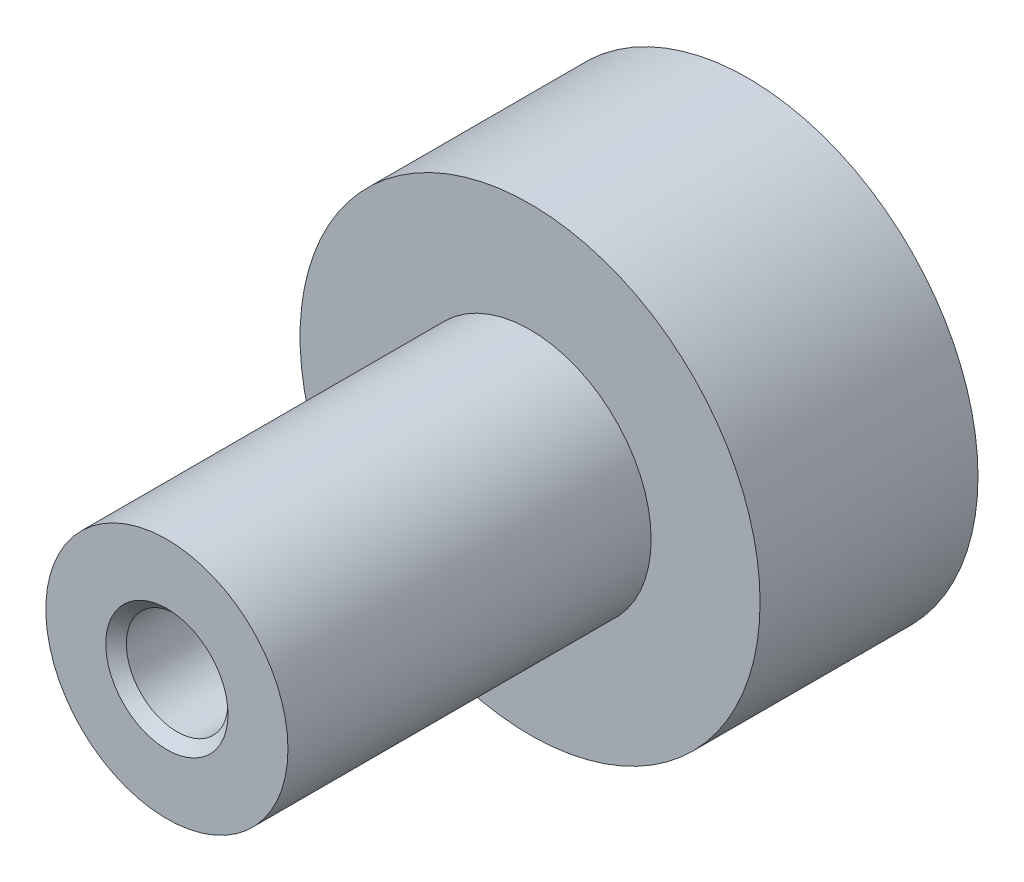
from build123d import *

# Parameters (mm, degrees)
SKETCH1_R                   = 9.5
SKETCH1_R_2                 = 8
BOSS_EXTRUDE1_DEPTH         = 6
SKETCH2_R                   = 9.5
BOSS_EXTRUDE2_DEPTH         = 3
SKETCH3_R                   = 5
BOSS_EXTRUDE3_DEPTH         = 15
CUT_EXTRUDE1_DEPTH          = 6
CIRPATTERN1_COUNT           = 5
M5_TAPPED_HOLE1_D           = 4.2
M5_TAPPED_HOLE1_DEPTH       = 15
M5_TAPPED_HOLE1_CSINK_D     = 5.05
M5_TAPPED_HOLE1_CSINK_ANGLE = 90
M5_TAPPED_HOLE1_TIP         = 1.2618073


with BuildPart() as part:
    # Sketch1 → Boss-Extrude1 (new body)
    with BuildSketch(Plane.XY):
        Circle(SKETCH1_R)
        Circle(SKETCH1_R_2, mode=Mode.SUBTRACT)
    extrude(amount=BOSS_EXTRUDE1_DEPTH)

    # Sketch2 → Boss-Extrude2 (add)
    with BuildSketch(Plane.XY.offset(6)):
        Circle(SKETCH2_R)
    extrude(amount=BOSS_EXTRUDE2_DEPTH)

    # Sketch3 → Boss-Extrude3 (add)
    with BuildSketch(Plane.XY.offset(9)):
        Circle(SKETCH3_R)
    extrude(amount=BOSS_EXTRUDE3_DEPTH)

    # Sketch4 → Cut-Extrude1 (cut)
    with BuildSketch(Plane(origin=(0, 0, 0), x_dir=(-1, 0, 0), z_dir=(0, 0, -1))):
        with BuildLine():
            Line((-7.72740661, 2.070552361), (-8.45185098, 2.264666645))
            ThreePointArc((-8.45185098, 2.264666645), (-6.187184335, 6.187184335), (-2.264666645, 8.45185098))
            Line((-2.264666645, 8.45185098), (-2.070552361, 7.72740661))
            ThreePointArc((-2.070552361, 7.72740661), (-5.656854249, 5.656854249), (-7.72740661, 2.070552361))
        make_face()
    cut_extrude1 = extrude(amount=-CUT_EXTRUDE1_DEPTH, mode=Mode.SUBTRACT)

    # CirPattern1: Cut-Extrude1 ×5 about axis
    cirpattern1_axis = Axis((0, 0, 0), (0, 0, 1))
    for i in range(1, CIRPATTERN1_COUNT):
        add(cut_extrude1.rotate(cirpattern1_axis, i * 360 / CIRPATTERN1_COUNT), mode=Mode.SUBTRACT)

    # M5 Tapped Hole1
    with Locations(Plane.XY.offset(24)):
        with Locations((0, 0)):
            CounterSinkHole(M5_TAPPED_HOLE1_D / 2, M5_TAPPED_HOLE1_CSINK_D / 2, depth=M5_TAPPED_HOLE1_DEPTH, counter_sink_angle=M5_TAPPED_HOLE1_CSINK_ANGLE)
            with Locations((0, 0, -(M5_TAPPED_HOLE1_DEPTH + M5_TAPPED_HOLE1_TIP / 2))):  # 118° drill point
                Cone(0, M5_TAPPED_HOLE1_D / 2, M5_TAPPED_HOLE1_TIP, mode=Mode.SUBTRACT)


solid = part.part
